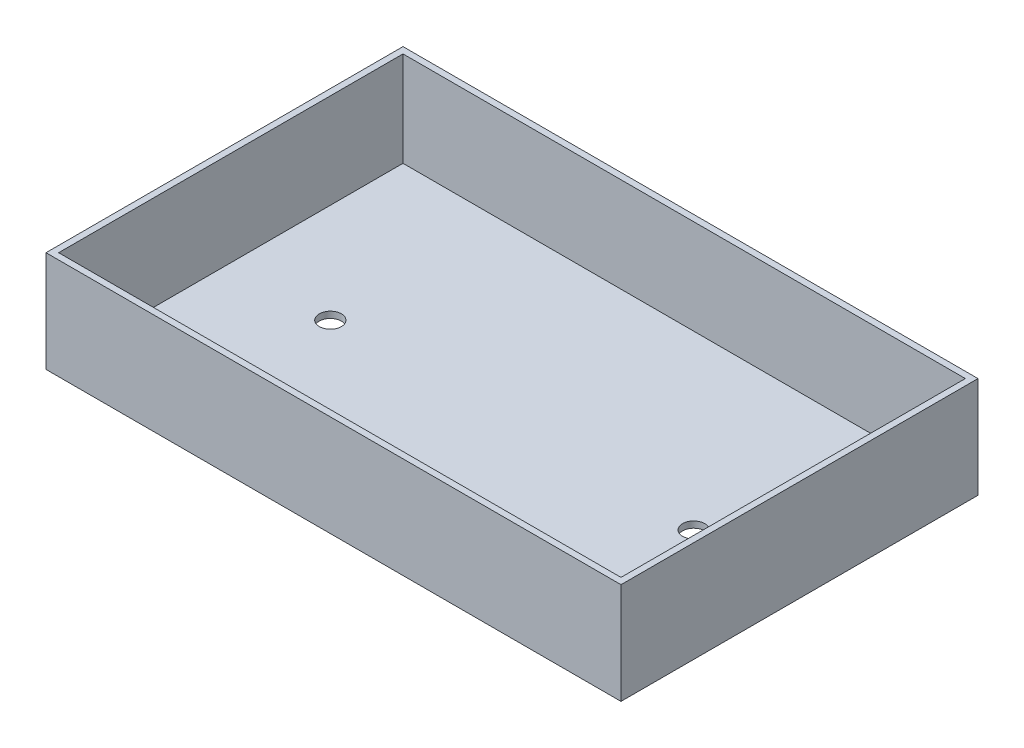
from build123d import *

# Parameters (mm, degrees)
SKETCH1_W           = 91
SKETCH1_H           = 56.5
BOSS_EXTRUDE1_DEPTH = 16
SKETCH2_W           = 89
SKETCH2_H           = 54.5
CUT_EXTRUDE1_DEPTH  = 15
SKETCH3_R           = 1.75
CUT_EXTRUDE2_DEPTH  = 15


with BuildPart() as part:
    # Sketch1 → Boss-Extrude1 (new body)
    with BuildSketch(Plane(origin=(0, 0, 0), x_dir=(1, 0, 0), z_dir=(0, 1, 0))):
        with Locations((45.5, 28.25)):
            Rectangle(SKETCH1_W, SKETCH1_H)
    extrude(amount=BOSS_EXTRUDE1_DEPTH)

    # Sketch2 → Cut-Extrude1 (cut)
    with BuildSketch(Plane(origin=(0, 16, 0), x_dir=(1, 0, 0), z_dir=(0, 1, 0))):
        with Locations((45.5, 28.25)):
            Rectangle(SKETCH2_W, SKETCH2_H)
    extrude(amount=-CUT_EXTRUDE1_DEPTH, mode=Mode.SUBTRACT)

    # Sketch3 → Cut-Extrude2 (cut)
    with BuildSketch(Plane(origin=(0, 1, 0), x_dir=(1, 0, 0), z_dir=(0, 1, 0))):
        with Locations(Location((16.75, 28.25, 0), (0, 0, 270))):
            Circle(SKETCH3_R)
        with Locations(Location((74.25, 28.25, 0), (0, 0, 90))):
            Circle(SKETCH3_R)
    extrude(amount=-CUT_EXTRUDE2_DEPTH, mode=Mode.SUBTRACT)


solid = part.part
